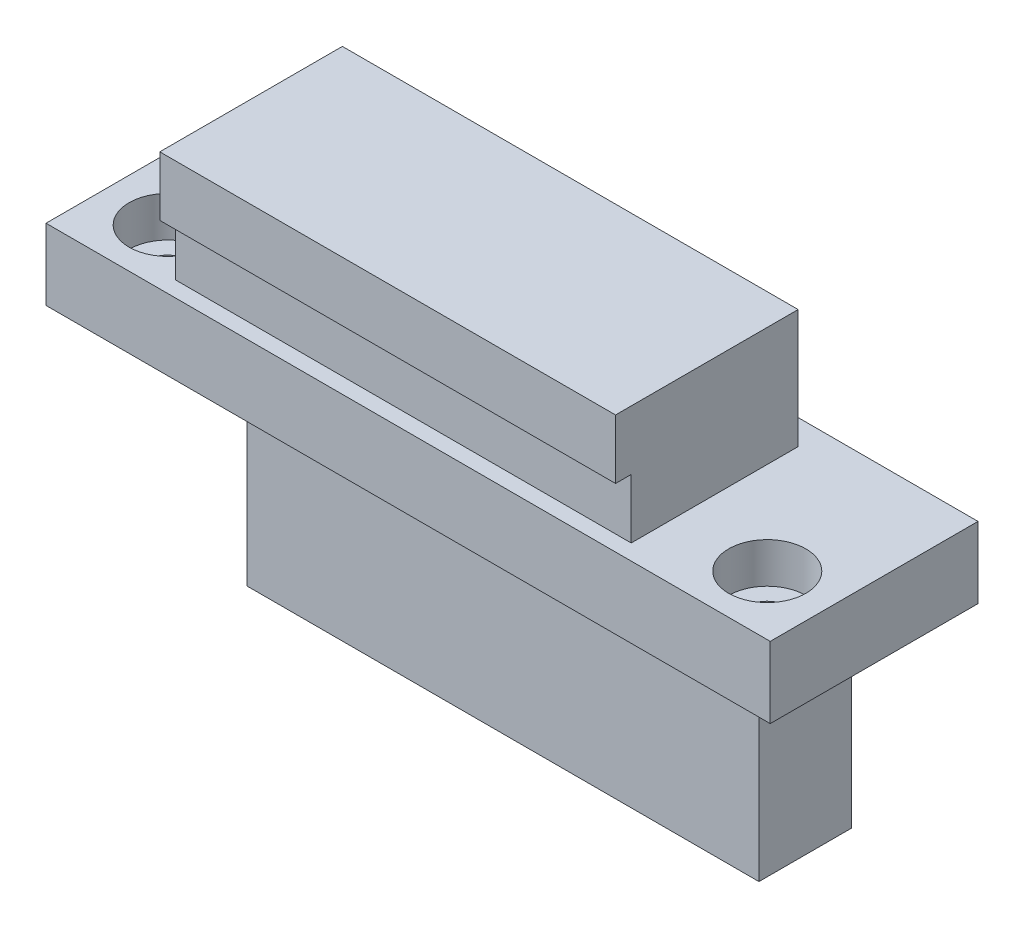
from build123d import *

# Parameters (mm, degrees)
SKICA1_W                                         = 61
SKICA1_H                                         = 17.5
P_IDAT_VYSUNUT_M1_DEPTH                          = 6
SKICA2_W                                         = 43.1
SKICA2_H                                         = 7.8
P_IDAT_VYSUNUT_M2_DEPTH                          = 20
V_LCOV_ZAHLOUBEN_PRO_M3_ROUBY_S_VNIT_D           = 3.4
V_LCOV_ZAHLOUBEN_PRO_M3_ROUBY_S_VNIT_DEPTH       = 10
V_LCOV_ZAHLOUBEN_PRO_M3_ROUBY_S_VNIT_CBORE_D     = 6.5
V_LCOV_ZAHLOUBEN_PRO_M3_ROUBY_S_VNIT_CBORE_DEPTH = 3.4
V_LCOV_ZAHLOUBEN_PRO_M3_ROUBY_S_VNIT_TIP         = 1.021463052
SKICA5_W                                         = 38.387641765
SKICA5_H                                         = 14.060547141
P_IDAT_VYSUNUT_M3_DEPTH                          = 10
SKICA6_W                                         = 38.387641765
SKICA6_H                                         = 5
P_IDAT_VYSUNUT_M4_DEPTH                          = 1.319108231


with BuildPart() as part:
    # Skica1 → Přidat vysunutím1 (new body)
    with BuildSketch(Plane(origin=(0, 0, 0), x_dir=(1, 0, 0), z_dir=(0, 1, 0))):
        Rectangle(SKICA1_W, SKICA1_H)
    extrude(amount=P_IDAT_VYSUNUT_M1_DEPTH)

    # Skica2 → Přidat vysunutím2 (add)
    with BuildSketch(Plane.XZ):
        with Locations((0, -3.15)):
            Rectangle(SKICA2_W, SKICA2_H)
    extrude(amount=P_IDAT_VYSUNUT_M2_DEPTH)

    # Válcové zahloubení pro M3 šrouby s vnitřním šestihranem1
    with Locations(Plane(origin=(0, 6, 0), x_dir=(1, 0, 0), z_dir=(0, 1, 0))):
        with Locations((-25.25, -3.75), (25.25, -3.75)):
            CounterBoreHole(V_LCOV_ZAHLOUBEN_PRO_M3_ROUBY_S_VNIT_D / 2, V_LCOV_ZAHLOUBEN_PRO_M3_ROUBY_S_VNIT_CBORE_D / 2, V_LCOV_ZAHLOUBEN_PRO_M3_ROUBY_S_VNIT_CBORE_DEPTH, depth=V_LCOV_ZAHLOUBEN_PRO_M3_ROUBY_S_VNIT_DEPTH)
            with Locations((0, 0, -(V_LCOV_ZAHLOUBEN_PRO_M3_ROUBY_S_VNIT_DEPTH + V_LCOV_ZAHLOUBEN_PRO_M3_ROUBY_S_VNIT_TIP / 2))):  # 118° drill point
                Cone(0, V_LCOV_ZAHLOUBEN_PRO_M3_ROUBY_S_VNIT_D / 2, V_LCOV_ZAHLOUBEN_PRO_M3_ROUBY_S_VNIT_TIP, mode=Mode.SUBTRACT)

    # Skica5 → Přidat vysunutím3 (add)
    with BuildSketch(Plane(origin=(0, 6, 0), x_dir=(1, 0, 0), z_dir=(0, 1, 0))):
        with Locations((-1.722409319, -0.400618199)):
            Rectangle(SKICA5_W, SKICA5_H)
    extrude(amount=P_IDAT_VYSUNUT_M3_DEPTH)

    # Skica6 → Přidat vysunutím4 (add)
    with BuildSketch(Plane.XY.offset(7.430891769)):
        with Locations((-1.722409319, 13.5)):
            Rectangle(SKICA6_W, SKICA6_H)
    extrude(amount=P_IDAT_VYSUNUT_M4_DEPTH)


solid = part.part
